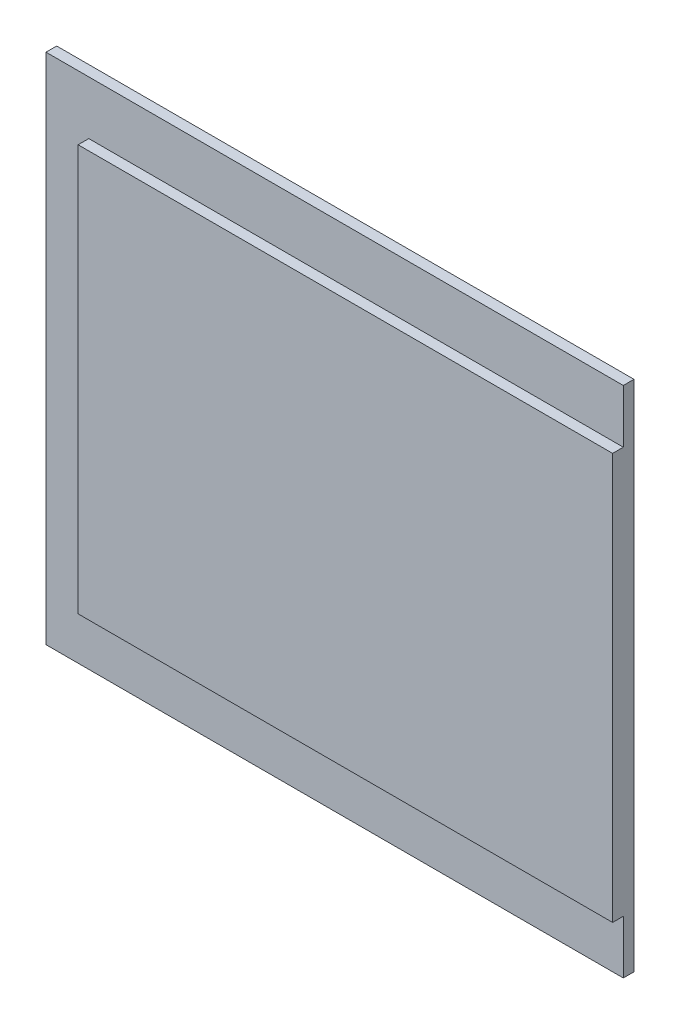
from build123d import *

# Parameters (mm, degrees)
SKETCH_1_W      = 54
SKETCH_1_H      = 48
EXTRUDE_1_DEPTH = 1
SKETCH_2_W      = 50
SKETCH_2_H      = 38
EXTRUDE_2_DEPTH = 1


with BuildPart() as part:
    # Эскиз1 → Бобышка-Вытянуть1 (new body)
    with BuildSketch(Plane.XY):
        Rectangle(SKETCH_1_W, SKETCH_1_H)
    extrude(amount=EXTRUDE_1_DEPTH)

    # Эскиз2 → Бобышка-Вытянуть2 (add)
    with BuildSketch(Plane.XY.offset(1)):
        with Locations((2, 0)):
            Rectangle(SKETCH_2_W, SKETCH_2_H)
    extrude(amount=EXTRUDE_2_DEPTH)


solid = part.part
